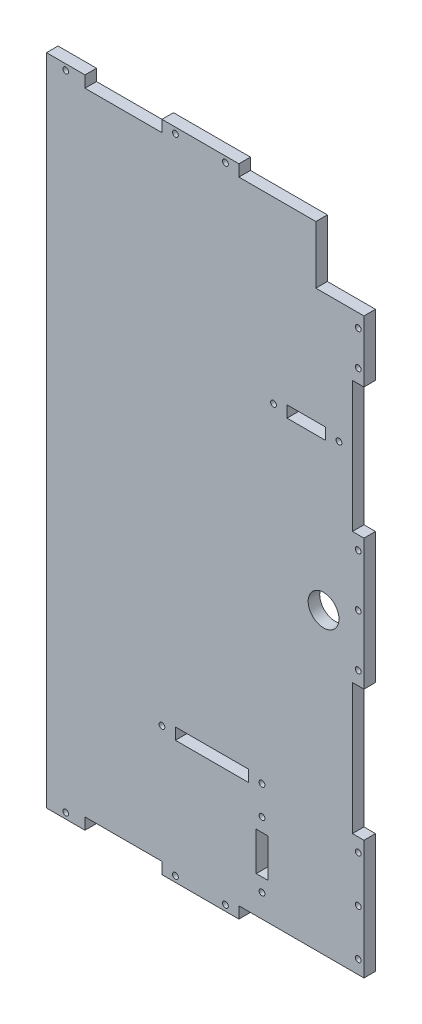
from build123d import *

# Parameters (mm, degrees)
ESQUISSE2_W                            = 330
ESQUISSE2_H                            = 340
BOSS_EXTRU_1_DEPTH                     = 6
ESQUISSE4_W                            = 65
ESQUISSE4_H                            = 6
ESQUISSE4_W_2                          = 40
ESQUISSE4_W_3                          = 6
ESQUISSE4_H_2                          = 68
ENL_V_MAT_ENCOCHE_BORD_DEPTH           = 474.852297662
ESQUISSE5_W                            = 38
ESQUISSE5_H                            = 6
ESQUISSE5_W_2                          = 15
ESQUISSE5_H_2                          = 10
ESQUISSE5_W_3                          = 25
ESQUISSE5_H_3                          = 30
ESQUISSE5_W_4                          = 20
ESQUISSE5_W_5                          = 6
ESQUISSE5_H_4                          = 20
ENL_V_MAT_ENCOCHE_TAGE_ROULETTES_DEPTH = 474.852297662
ESQUISSE6_R                            = 8
ENL_V_MAT_EXTRU_1_DEPTH                = 10
ESQUISSE7_W                            = 170.318171934
ESQUISSE7_H                            = 348.032193401
ENL_V_MAT_EXTRU_2_DEPTH                = 474.852297662
ESQUISSE8_R                            = 1.5
ENL_V_MAT_EXTRU_3_DEPTH                = 378.969575495
ESQUISSE9_R                            = 2.995
ESQUISSE9_R_2                          = 3
ENL_V_MAT_EXTRU_4_DEPTH                = 3


with BuildPart() as part:
    # Esquisse2 → Boss.-Extru.1 (new body)
    with BuildSketch(Plane.XY):
        with Locations((-165, -170)):
            Rectangle(ESQUISSE2_W, ESQUISSE2_H)
    extrude(amount=BOSS_EXTRU_1_DEPTH)

    # Esquisse4 → Enlèv. mat encoche bord (cut, through all)
    with BuildSketch(Plane(origin=(0, 0, 0), x_dir=(-1, 0, 0), z_dir=(0, 0, -1))):
        with Locations((297.5, -3)):
            Rectangle(ESQUISSE4_W, ESQUISSE4_H)
        with Locations((205, -3)):
            Rectangle(ESQUISSE4_W_2, ESQUISSE4_H)
        with Locations((125, -3)):
            Rectangle(ESQUISSE4_W_2, ESQUISSE4_H)
        with Locations((32.5, -3)):
            Rectangle(ESQUISSE4_W, ESQUISSE4_H)
        with Locations((327, -102)):
            Rectangle(ESQUISSE4_W_3, ESQUISSE4_H_2)
        with Locations((3, -102)):
            Rectangle(ESQUISSE4_W_3, ESQUISSE4_H_2)
        with Locations((297.5, -337)):
            Rectangle(ESQUISSE4_W, ESQUISSE4_H)
        with Locations((205, -337)):
            Rectangle(ESQUISSE4_W_2, ESQUISSE4_H)
        with Locations((125, -337)):
            Rectangle(ESQUISSE4_W_2, ESQUISSE4_H)
        with Locations((32.5, -337)):
            Rectangle(ESQUISSE4_W, ESQUISSE4_H)
        with Locations((327, -238)):
            Rectangle(ESQUISSE4_W_3, ESQUISSE4_H_2)
        with Locations((3, -238)):
            Rectangle(ESQUISSE4_W_3, ESQUISSE4_H_2)
    extrude(amount=-ENL_V_MAT_ENCOCHE_BORD_DEPTH, mode=Mode.SUBTRACT)

    # Esquisse5 → Enlèv. mat encoche étage + roulettes (cut, through all)
    with BuildSketch(Plane(origin=(0, 0, 0), x_dir=(-1, 0, 0), z_dir=(0, 0, -1))):
        with Locations((251, -273)):
            Rectangle(ESQUISSE5_W, ESQUISSE5_H)
        with Locations((79, -273)):
            Rectangle(ESQUISSE5_W, ESQUISSE5_H)
        with Locations((322.5, -11)):
            Rectangle(ESQUISSE5_W_2, ESQUISSE5_H_2)
        with Locations((12.5, -21)):
            Rectangle(ESQUISSE5_W_3, ESQUISSE5_H_3)
        with Locations((300, -99)):
            Rectangle(ESQUISSE5_W_4, ESQUISSE5_H)
        with Locations((30, -99)):
            Rectangle(ESQUISSE5_W_4, ESQUISSE5_H)
        with Locations((53, -305)):
            Rectangle(ESQUISSE5_W_5, ESQUISSE5_H_4)
    extrude(amount=-ENL_V_MAT_ENCOCHE_TAGE_ROULETTES_DEPTH, mode=Mode.SUBTRACT)

    # Esquisse6 → Enlèv. mat.-Extru.1 (cut)
    with BuildSketch(Plane.XY.offset(6)):
        with Locations((-21, -178.92)):
            Circle(ESQUISSE6_R)
        with Locations((-309, -178.92)):
            Circle(ESQUISSE6_R)
    extrude(amount=-ENL_V_MAT_EXTRU_1_DEPTH, mode=Mode.SUBTRACT)

    # Esquisse7 → Enlèv. mat.-Extru.2 (cut, through all)
    with BuildSketch(Plane.XY.offset(6)):
        with Locations((-250.159085967, -174.016096701)):
            Rectangle(ESQUISSE7_W, ESQUISSE7_H)
    extrude(amount=-ENL_V_MAT_EXTRU_2_DEPTH, mode=Mode.SUBTRACT)

    # Esquisse8 → Enlèv. mat.-Extru.3 (cut, through all)
    with BuildSketch(Plane(origin=(0, 0, 0), x_dir=(-1, 0, 0), z_dir=(0, 0, -1))):
        with Locations((155, -337)):
            Circle(ESQUISSE8_R)
        with Locations((98, -337)):
            Circle(ESQUISSE8_R)
        with Locations((72, -337)):
            Circle(ESQUISSE8_R)
        with Locations((3, -327)):
            Circle(ESQUISSE8_R)
        with Locations((3, -303)):
            Circle(ESQUISSE8_R)
        with Locations((3, -279)):
            Circle(ESQUISSE8_R)
        with Locations((53, -288)):
            Circle(ESQUISSE8_R)
        with Locations((53, -322)):
            Circle(ESQUISSE8_R)
        with Locations((53, -273)):
            Circle(ESQUISSE8_R)
        with Locations((105, -273)):
            Circle(ESQUISSE8_R)
        with Locations((3, -197)):
            Circle(ESQUISSE8_R)
        with Locations((3, -170)):
            Circle(ESQUISSE8_R)
        with Locations((3, -143)):
            Circle(ESQUISSE8_R)
        with Locations((3, -61)):
            Circle(ESQUISSE8_R)
        with Locations((3, -43)):
            Circle(ESQUISSE8_R)
        with Locations((98, -3)):
            Circle(ESQUISSE8_R)
        with Locations((72, -3)):
            Circle(ESQUISSE8_R)
        with Locations((155, -3)):
            Circle(ESQUISSE8_R)
        with Locations((47, -99)):
            Circle(ESQUISSE8_R)
        with Locations((13, -99)):
            Circle(ESQUISSE8_R)
    extrude(amount=-ENL_V_MAT_EXTRU_3_DEPTH, mode=Mode.SUBTRACT)

    # Esquisse9 → Enlèv. mat.-Extru.4 (cut)
    with BuildSketch(Plane(origin=(0, 0, 0), x_dir=(-1, 0, 0), z_dir=(0, 0, -1))):
        with Locations((155, -337)):
            Circle(ESQUISSE9_R)
        with Locations((98, -337)):
            Circle(ESQUISSE9_R)
        with Locations((72, -337)):
            Circle(ESQUISSE9_R)
        with Locations((53, -322)):
            Circle(ESQUISSE9_R_2)
        with Locations((53, -288)):
            Circle(ESQUISSE9_R)
        with Locations((53, -273)):
            Circle(ESQUISSE9_R)
        with Locations((105, -273)):
            Circle(ESQUISSE9_R)
        with Locations((3, -279)):
            Circle(ESQUISSE9_R)
        with Locations((3, -303)):
            Circle(ESQUISSE9_R)
        with Locations((3, -327)):
            Circle(ESQUISSE9_R)
        with Locations((3, -197)):
            Circle(ESQUISSE9_R)
        with Locations((3, -170)):
            Circle(ESQUISSE9_R)
        with Locations((3, -143)):
            Circle(ESQUISSE9_R)
        with Locations((47, -99)):
            Circle(ESQUISSE9_R_2)
        with Locations((13, -99)):
            Circle(ESQUISSE9_R_2)
        with Locations((3, -61)):
            Circle(ESQUISSE9_R)
        with Locations((3, -43)):
            Circle(ESQUISSE9_R)
        with Locations((98, -3)):
            Circle(ESQUISSE9_R)
        with Locations((72, -3)):
            Circle(ESQUISSE9_R)
        with Locations((155, -3)):
            Circle(ESQUISSE9_R)
    extrude(amount=-ENL_V_MAT_EXTRU_4_DEPTH, mode=Mode.SUBTRACT)


solid = part.part
